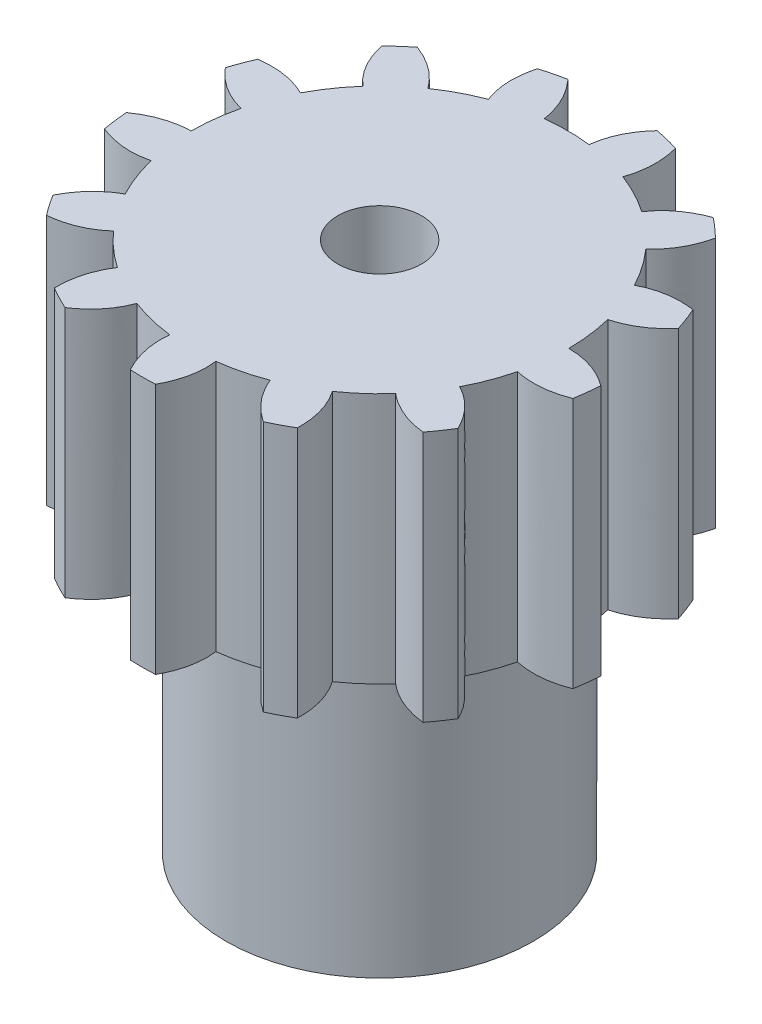
from build123d import *

# Parameters (mm, degrees)
SKETCH1_R           = 1.5
BOSS_EXTRUDE1_DEPTH = 9
SKETCH2_R           = 5.5
BOSS_EXTRUDE2_DEPTH = 10
L_EK2_SCALE         = 2


with BuildPart() as part:
    # Sketch1 → Boss-Extrude1 (new body)
    with BuildSketch(Plane(origin=(0, 0, 0), x_dir=(1, 0, 0), z_dir=(0, 1, 0))):
        with BuildLine():
            add(Edge.make_bspline(
                [(-5.065227978, 4.461610195), (-5.526615005, 4.86619147), (-5.830003112, 5.39406146), (-5.975392301, 6.045220165)],
                knots=[0, 0, 0, 0, 0.872429449, 0.872429449, 0.872429449, 0.872429449], degree=3))
            ThreePointArc((-5.065227978, 4.461610195), (-5.560258819, 3.827012132), (-5.976238464, 3.138004752))
            add(Edge.make_bspline(
                [(-7.780961116, 3.42149735), (-7.125870497, 3.507536778), (-6.52429628, 3.413039245), (-5.976238464, 3.138004752)],
                knots=[0.127683247, 0.127683247, 0.127683247, 0.127683247, 1, 1, 1, 1], degree=3))
            ThreePointArc((-7.780961116, 3.42149735), (-7.951879756, 3.00293329), (-8.10030101, 2.575873357))
            add(Edge.make_bspline(
                [(-6.558450277, 1.596630818), (-7.155006493, 1.740452504), (-7.668956737, 2.066866683), (-8.10030101, 2.575873357)],
                knots=[0, 0, 0, 0, 0.872429449, 0.872429449, 0.872429449, 0.872429449], degree=3))
            ThreePointArc((-6.558450277, 1.596630818), (-6.701865893, 0.804669837), (-6.749999881, 0.00126872))
            add(Edge.make_bspline(
                [(-8.479748007, -0.586407486), (-7.939678588, -0.205787566), (-7.363095879, -0.009895497), (-6.749999881, 0.00126872)],
                knots=[0.127683247, 0.127683247, 0.127683247, 0.127683247, 1, 1, 1, 1], degree=3))
            ThreePointArc((-8.479748007, -0.586407486), (-8.436572529, -1.036457408), (-8.369528376, -1.483574994))
            add(Edge.make_bspline(
                [(-6.549210655, -1.634117437), (-7.144272221, -1.784003157), (-7.751044795, -1.733822342), (-8.369528376, -1.483574994)],
                knots=[0, 0, 0, 0, 0.872429449, 0.872429449, 0.872429449, 0.872429449], degree=3))
            ThreePointArc((-6.549210655, -1.634117437), (-6.308156258, -2.402012621), (-5.977417671, -3.13575796))
            add(Edge.make_bspline(
                [(-7.235926822, -4.459973434), (-6.934601997, -3.871968458), (-6.515098947, -3.4305633), (-5.977417671, -3.13575796)],
                knots=[0.127683247, 0.127683247, 0.127683247, 0.127683247, 1, 1, 1, 1], degree=3))
            ThreePointArc((-7.235926822, -4.459973434), (-6.988548208, -4.838408204), (-6.721397655, -5.203154193))
            add(Edge.make_bspline(
                [(-5.039625799, -4.490509081), (-5.496871281, -4.899765193), (-6.0574619, -5.137313564), (-6.721397655, -5.203154193)],
                knots=[0, 0, 0, 0, 0.872429449, 0.872429449, 0.872429449, 0.872429449], degree=3))
            ThreePointArc((-5.039625799, -4.490509081), (-4.469324045, -5.058422935), (-3.835481109, -5.554420281))
            add(Edge.make_bspline(
                [(-4.334442004, -7.311813216), (-4.34089166, -6.651128039), (-4.174571361, -6.065330394), (-3.835481109, -5.554420281)],
                knots=[0.127683247, 0.127683247, 0.127683247, 0.127683247, 1, 1, 1, 1], degree=3))
            ThreePointArc((-4.334442004, -7.311813216), (-3.939531713, -7.53193799), (-3.533475733, -7.730753472))
            add(Edge.make_bspline(
                [(-2.375523406, -6.318179211), (-2.590203375, -6.893050073), (-2.976187484, -7.36390816), (-3.533475733, -7.730753472)],
                knots=[0, 0, 0, 0, 0.872429449, 0.872429449, 0.872429449, 0.872429449], degree=3))
            ThreePointArc((-2.375523406, -6.318179211), (-1.606623554, -6.556009515), (-0.814882047, -6.700631854))
            add(Edge.make_bspline(
                [(-0.439988759, -8.488604708), (-0.752735357, -7.906594341), (-0.877699786, -7.31060339), (-0.814882047, -6.700631854)],
                knots=[0.127683247, 0.127683247, 0.127683247, 0.127683247, 1, 1, 1, 1], degree=3))
            ThreePointArc((-0.439988759, -8.488604708), (0.011984021, -8.499991552), (0.463922896, -8.487330296))
            add(Edge.make_bspline(
                [(0.832782771, -6.698430626), (0.909848909, -7.307220251), (0.786895617, -7.903520141), (0.463922896, -8.487330296)],
                knots=[0, 0, 0, 0, 0.872429449, 0.872429449, 0.872429449, 0.872429449], degree=3))
            ThreePointArc((0.832782771, -6.698430626), (1.624135031, -6.551693323), (2.392396671, -6.311809421))
            add(Edge.make_bspline(
                [(3.555260608, -7.72075916), (3.007863545, -7.350755165), (2.620242233, -6.881105252), (2.392396671, -6.311809421)],
                knots=[0.127683247, 0.127683247, 0.127683247, 0.127683247, 1, 1, 1, 1], degree=3))
            ThreePointArc((3.555260608, -7.72075916), (3.96075436, -7.520799485), (4.355042381, -7.299562032))
            add(Edge.make_bspline(
                [(3.850308451, -5.54415231), (4.201465773, -6.047394331), (4.369710416, -6.632530905), (4.355042381, -7.299562032)],
                knots=[0, 0, 0, 0, 0.872429449, 0.872429449, 0.872429449, 0.872429449], degree=3))
            ThreePointArc((3.850308451, -5.54415231), (4.482823853, -5.046463148), (5.051606144, -4.477027515))
            add(Edge.make_bspline(
                [(6.736042616, -5.184180734), (6.079397157, -5.110946566), (5.517918333, -4.875228826), (5.051606144, -4.477027515)],
                knots=[0.127683247, 0.127683247, 0.127683247, 0.127683247, 1, 1, 1, 1], degree=3))
            ThreePointArc((6.736042616, -5.184180734), (7.002163607, -4.818682892), (7.24847414, -4.439552076))
            add(Edge.make_bspline(
                [(5.985774866, -3.119775513), (6.530577461, -3.402183249), (6.951477219, -3.84210877), (7.24847414, -4.439552076)],
                knots=[0, 0, 0, 0, 0.872429449, 0.872429449, 0.872429449, 0.872429449], degree=3))
            ThreePointArc((5.985774866, -3.119775513), (6.314551754, -2.385149082), (6.553553527, -1.616612559))
            add(Edge.make_bspline(
                [(8.373678438, -1.459968977), (7.758214146, -1.700281702), (7.151505842, -1.75249623), (6.553553527, -1.616612559)],
                knots=[0.127683247, 0.127683247, 0.127683247, 0.127683247, 1, 1, 1, 1], degree=3))
            ThreePointArc((8.373678438, -1.459968977), (8.439461558, -1.01266412), (8.481367828, -0.562494242))
            add(Edge.make_bspline(
                [(6.749972396, 0.019304256), (7.363612555, 0.022427015), (7.940744366, -0.171505818), (8.481367828, -0.562494242)],
                knots=[0, 0, 0, 0, 0.872429449, 0.872429449, 0.872429449, 0.872429449], degree=3))
            ThreePointArc((6.749972396, 0.019304256), (6.699691947, 0.822573894), (6.554160776, 1.614148852))
            add(Edge.make_bspline(
                [(8.093005444, 2.598704077), (7.65971777, 2.099897208), (7.146769547, 1.771712133), (6.554160776, 1.614148852)],
                knots=[0.127683247, 0.127683247, 0.127683247, 0.127683247, 1, 1, 1, 1], degree=3))
            ThreePointArc((8.093005444, 2.598704077), (7.943380571, 3.025343799), (7.771282357, 3.443424244))
            add(Edge.make_bspline(
                [(5.967832596, 3.153961653), (6.509732754, 3.44189952), (7.110882674, 3.53838705), (7.771282357, 3.443424244)],
                knots=[0, 0, 0, 0, 0.872429449, 0.872429449, 0.872429449, 0.872429449], degree=3))
            ThreePointArc((5.967832596, 3.153961653), (5.550013455, 3.841855105), (5.053288778, 4.475128213))
            add(Edge.make_bspline(
                [(5.958322434, 6.062045345), (5.806472362, 5.419014975), (5.504794477, 4.890042598), (5.053288778, 4.475128213)],
                knots=[0.127683247, 0.127683247, 0.127683247, 0.127683247, 1, 1, 1, 1], degree=3))
            ThreePointArc((5.958322434, 6.062045345), (5.627566824, 6.370281912), (5.280889753, 6.660495734))
            add(Edge.make_bspline(
                [(3.818534268, 5.566084444), (4.16455163, 6.072874324), (4.652003458, 6.437678087), (5.280889753, 6.660495734)],
                knots=[0, 0, 0, 0, 0.872429449, 0.872429449, 0.872429449, 0.872429449], degree=3))
            ThreePointArc((3.818534268, 5.566084444), (3.128893766, 5.98101361), (2.394769219, 6.310909632))
            add(Edge.make_bspline(
                [(2.45865956, 8.136645081), (2.623034112, 7.496701718), (2.601737332, 6.888123235), (2.394769219, 6.310909632)],
                knots=[0.127683247, 0.127683247, 0.127683247, 0.127683247, 1, 1, 1, 1], degree=3))
            ThreePointArc((2.45865956, 8.136645081), (2.022545337, 8.25586521), (1.580708948, 8.351727918))
            add(Edge.make_bspline(
                [(0.794455758, 6.703084368), (0.865321915, 7.312626807), (1.127406312, 7.862174657), (1.580708948, 8.351727918)],
                knots=[0, 0, 0, 0, 0.872429449, 0.872429449, 0.872429449, 0.872429449], degree=3))
            ThreePointArc((0.794455758, 6.703084368), (-0.009017778, 6.749993976), (-0.812363108, 6.700937709))
            add(Edge.make_bspline(
                [(-1.604252589, 8.347237485), (-1.161309642, 7.856984441), (-0.897346481, 7.308217849), (-0.812363108, 6.700937709)],
                knots=[0.127683247, 0.127683247, 0.127683247, 0.127683247, 1, 1, 1, 1], degree=3))
            ThreePointArc((-1.604252589, 8.347237485), (-2.045816912, 8.250129282), (-2.481593228, 8.129679886))
            add(Edge.make_bspline(
                [(-2.411622992, 6.304488444), (-2.632142622, 6.877144615), (-2.655466033, 7.485541762), (-2.481593228, 8.129679886)],
                knots=[0, 0, 0, 0, 0.872429449, 0.872429449, 0.872429449, 0.872429449], degree=3))
            ThreePointArc((-2.411622992, 6.304488444), (-3.144863458, 5.972632069), (-3.833392837, 5.555861712))
            add(Edge.make_bspline(
                [(-5.299649804, 6.645578377), (-4.679611352, 6.417326717), (-4.19085903, 6.054087828), (-3.833392837, 5.555861712)],
                knots=[0.127683247, 0.127683247, 0.127683247, 0.127683247, 1, 1, 1, 1], degree=3))
            ThreePointArc((-5.299649804, 6.645578377), (-5.645507162, 6.35438816), (-5.975392301, 6.045220165))
        make_face()
        with Locations(Location((0, 0, 0), (0, 0, 270))):
            Circle(SKETCH1_R, mode=Mode.SUBTRACT)
    extrude(amount=BOSS_EXTRUDE1_DEPTH)

    # Sketch2 → Boss-Extrude2 (add)
    with BuildSketch(Plane.XZ):
        with Locations(Location((0, 0, 0), (0, 0, 90))):
            Circle(SKETCH2_R)
    extrude(amount=BOSS_EXTRUDE2_DEPTH)


with BuildPart() as part_1:
    # Ölçek2: scaled about (0, 0.855834843, 0)
    add(part.part.scale(L_EK2_SCALE).moved(Location((0, -0.855834843, 0))))


solid = part_1.part
